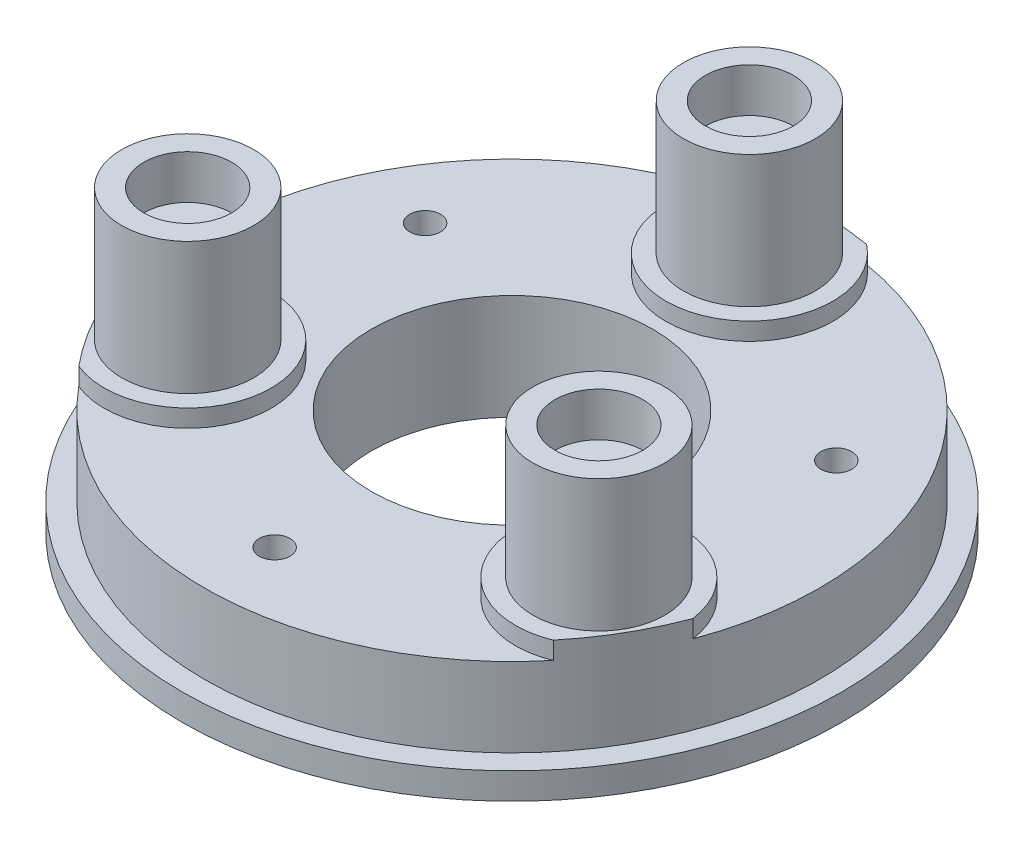
from build123d import *

# Parameters (mm, degrees)
SKETCH1_R                                     = 37.5
BOSS_EXTRUDE1_DEPTH                           = 3
SKETCH1_3_R                                   = 35
BOSS_EXTRUDE2_DEPTH                           = 12
SKETCH13_R                                    = 16
CUT_EXTRUDE6_DEPTH                            = 55.373706881
BOSS_EXTRUDE9_DEPTH                           = 2
SKETCH25_R                                    = 7.5
BOSS_EXTRUDE10_DEPTH                          = 15
SKETCH26_R                                    = 5
CUT_EXTRUDE9_DEPTH                            = 5
CBORE_FOR_M3_PAN_HEAD_MACHINE_SCREW1_AT_COUNT = 2
CBORE_FOR_M3_PAN_HEAD_MACHINE_SCREW1_AT_PITCH = 46.765371804
CBORE_FOR_M3_PAN_HEAD_MACHINE_SCREW1_2_COUNT  = 2
CBORE_FOR_M3_PAN_HEAD_MACHINE_SCREW1_2_PITCH  = 46.765371804
SKETCH29_R                                    = 1.75
CUT_EXTRUDE10_DEPTH                           = 56.691112397


with BuildPart() as part:
    # Sketch1 → Boss-Extrude1 (new body)
    with BuildSketch(Plane(origin=(0, 0, 0), x_dir=(1, 0, 0), z_dir=(0, 1, 0))):
        Circle(SKETCH1_R)
    extrude(amount=BOSS_EXTRUDE1_DEPTH)

    # Sketch1<3> → Boss-Extrude2 (add)
    with BuildSketch(Plane(origin=(0, 0, 0), x_dir=(1, 0, 0), z_dir=(0, 1, 0))):
        Circle(SKETCH1_3_R)
    extrude(amount=BOSS_EXTRUDE2_DEPTH)

    # Sketch13 → Cut-Extrude6 (cut, through all)
    with BuildSketch(Plane(origin=(0, 12, 0), x_dir=(1, 0, 0), z_dir=(0, 1, 0))):
        Circle(SKETCH13_R)
    extrude(amount=-CUT_EXTRUDE6_DEPTH, mode=Mode.SUBTRACT)

    # Sketch24 → Boss-Extrude9 (add)
    with BuildSketch(Plane(origin=(0, 12, 0), x_dir=(1, 0, 0), z_dir=(0, 1, 0))):
        with BuildLine():
            ThreePointArc((5.813043417, 34.513888889), (0, 35), (-5.813043417, 34.513888889))
            ThreePointArc((-5.813043417, 34.513888889), (0, 17.5), (5.813043417, 34.513888889))
        make_face()
        with BuildLine():
            ThreePointArc((-26.983382853, -22.291187717), (-15.155444566, -8.75), (-32.79642627, -12.222701172))
            ThreePointArc((-32.79642627, -12.222701172), (-30.310889132, -17.5), (-26.983382853, -22.291187717))
        make_face()
        with BuildLine():
            ThreePointArc((26.983382853, -22.291187717), (30.310889132, -17.5), (32.79642627, -12.222701172))
            ThreePointArc((32.79642627, -12.222701172), (15.155444566, -8.75), (26.983382853, -22.291187717))
        make_face()
    extrude(amount=BOSS_EXTRUDE9_DEPTH)

    # Sketch25 → Boss-Extrude10 (add)
    with BuildSketch(Plane(origin=(0, 14, 0), x_dir=(1, 0, 0), z_dir=(0, 1, 0))):
        with Locations((0, 27)):
            Circle(SKETCH25_R)
        with Locations((23.382685902, -13.5)):
            Circle(SKETCH25_R)
        with Locations((-23.382685902, -13.5)):
            Circle(SKETCH25_R)
    extrude(amount=BOSS_EXTRUDE10_DEPTH)

    # Sketch26 → Cut-Extrude9 (cut)
    with BuildSketch(Plane(origin=(0, 29, 0), x_dir=(1, 0, 0), z_dir=(0, 1, 0))):
        with Locations((0, 27)):
            Circle(SKETCH26_R)
        with Locations((23.382685902, -13.5)):
            Circle(SKETCH26_R)
        with Locations((-23.382685902, -13.5)):
            Circle(SKETCH26_R)
    extrude(amount=-CUT_EXTRUDE9_DEPTH, mode=Mode.SUBTRACT)

    # Sketch28 → CBORE for M3 Pan Head Machine Screw1 (revolve, cut)
    with BuildSketch(Plane(origin=(0, 0, -27), x_dir=(0, 0, -1), z_dir=(1, 0, 0))):
        Polygon((0, 0), (0, 29), (1.8, 29), (1.8, 2.4), (3.5, 2.4), (3.5, 0.025), (3.525, 0), align=None)
    cbore_for_m3_pan_head_machine_screw1 = revolve(axis=Axis((0, -6.35, -27), (0, 1, 0)), mode=Mode.SUBTRACT)

    # CBORE for M3 Pan Head Machine Screw1 at: CBORE for M3 Pan Head Machine Screw1 ×2
    with Locations(*[Vector(-0.5000000000000369, 0, 0.8660254037844174) * (i * CBORE_FOR_M3_PAN_HEAD_MACHINE_SCREW1_AT_PITCH) for i in range(1, CBORE_FOR_M3_PAN_HEAD_MACHINE_SCREW1_AT_COUNT)]):
        add(cbore_for_m3_pan_head_machine_screw1, mode=Mode.SUBTRACT)

    # CBORE for M3 Pan Head Machine Screw1 2: CBORE for M3 Pan Head Machine Screw1 ×2
    with Locations(*[Vector(0.49999999999996353, 0, 0.8660254037844598) * (i * CBORE_FOR_M3_PAN_HEAD_MACHINE_SCREW1_2_PITCH) for i in range(1, CBORE_FOR_M3_PAN_HEAD_MACHINE_SCREW1_2_COUNT)]):
        add(cbore_for_m3_pan_head_machine_screw1, mode=Mode.SUBTRACT)

    # Sketch29 → Cut-Extrude10 (cut, through all)
    with BuildSketch(Plane(origin=(0, 12, 0), x_dir=(1, 0, 0), z_dir=(0, 1, 0))):
        with Locations((23.382685902, 13.5)):
            Circle(SKETCH29_R)
        with Locations((0, -27)):
            Circle(SKETCH29_R)
        with Locations((-23.382685902, 13.5)):
            Circle(SKETCH29_R)
    extrude(amount=-CUT_EXTRUDE10_DEPTH, mode=Mode.SUBTRACT)


solid = part.part
